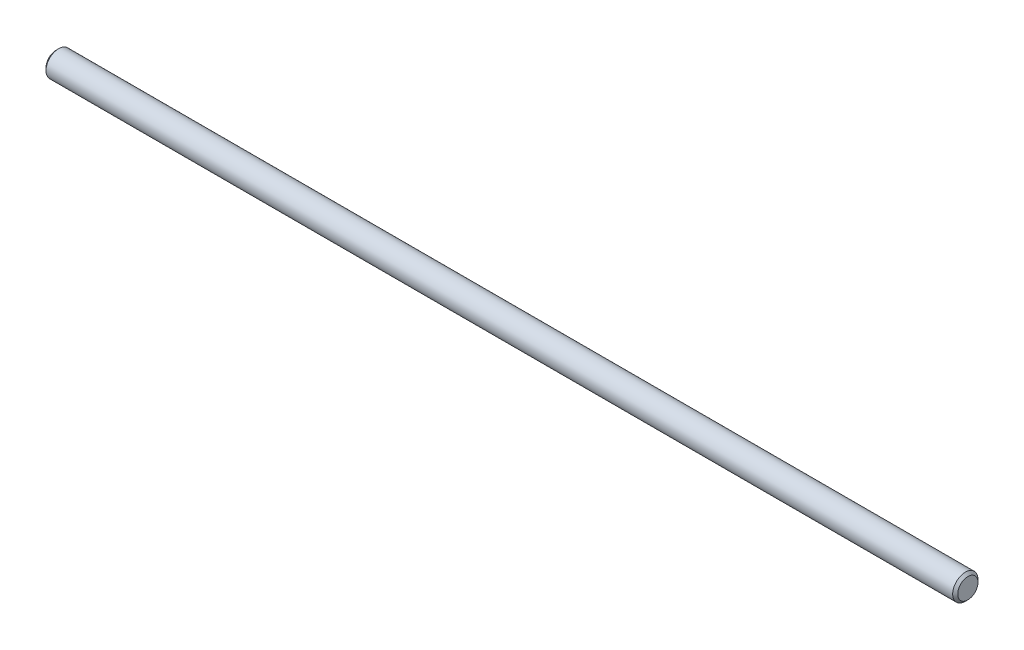
from build123d import *

# Parameters (mm, degrees)
EXTRUDE1_DEPTH      = 114.3
EXTRUDE1_DEPTH_BACK = 114.3
SKETCH2_R           = 3.175
CHAMFER1_SIZE       = 0.635


with BuildPart() as part:
    # Sketch2 → Extrude1 (new, two sides: drawn at the far end of the back side and taken through both)
    with BuildSketch(Plane(origin=(0, 0, 0), x_dir=(0, 0, -1), z_dir=(1, 0, 0)).offset(-EXTRUDE1_DEPTH_BACK)):
        Circle(SKETCH2_R)
    extrude(amount=EXTRUDE1_DEPTH + EXTRUDE1_DEPTH_BACK)

    # Chamfer1
    chamfer1_edges = [part.edges().sort_by_distance(p)[0] for p in [
        (-114.3, 0, 3.175),
        (114.3, 0, 3.175),
    ]]
    chamfer(chamfer1_edges, length=CHAMFER1_SIZE)


solid = part.part
